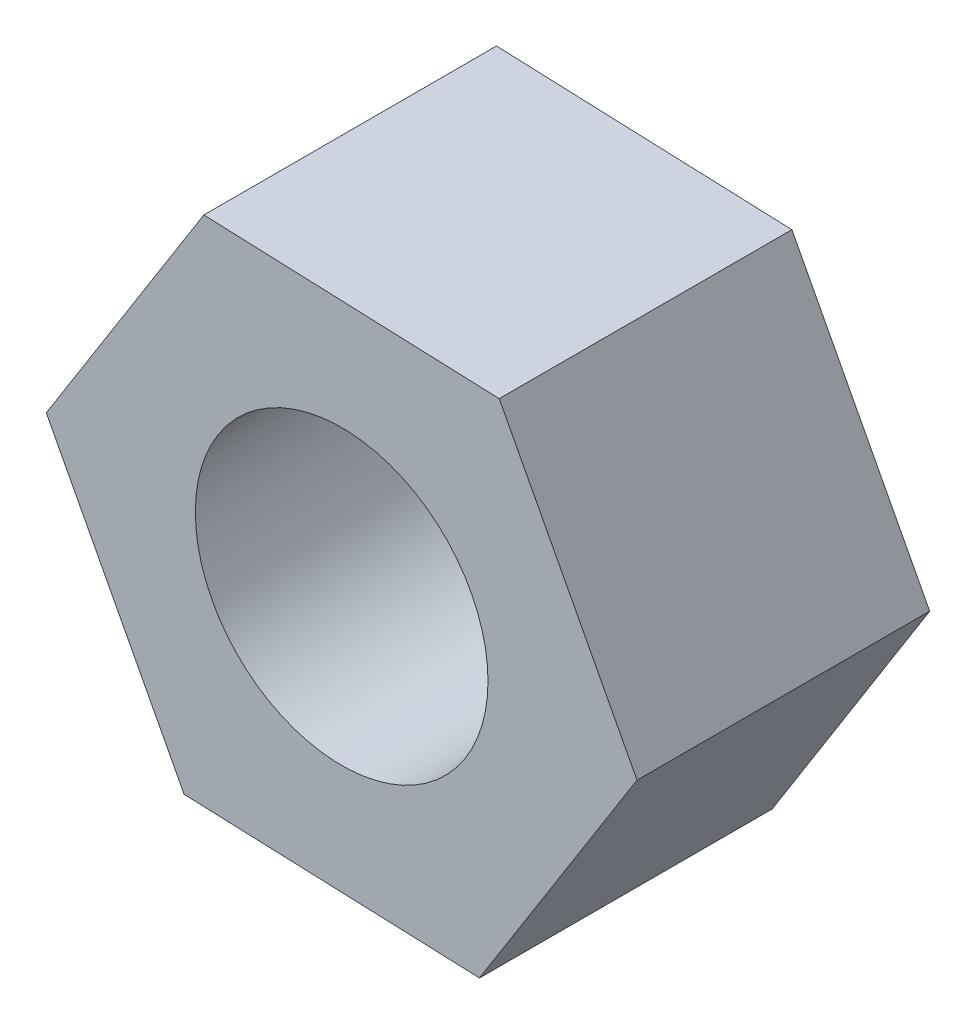
from build123d import *

# Parameters (mm, degrees)
SKETCH1_R           = 2
BOSS_EXTRUDE1_DEPTH = 4


with BuildPart() as part:
    # Sketch1 → Boss-Extrude1 (new body)
    with BuildSketch(Plane.XY):
        Polygon((-2.153320876, -3.418305019), (1.883678547, -3.573983091), (4.036999423, -0.155678071), (2.153320876, 3.418305019), (-1.883678547, 3.573983091), (-4.036999423, 0.155678071), align=None)
        Circle(SKETCH1_R, mode=Mode.SUBTRACT)
    extrude(amount=BOSS_EXTRUDE1_DEPTH)


solid = part.part
